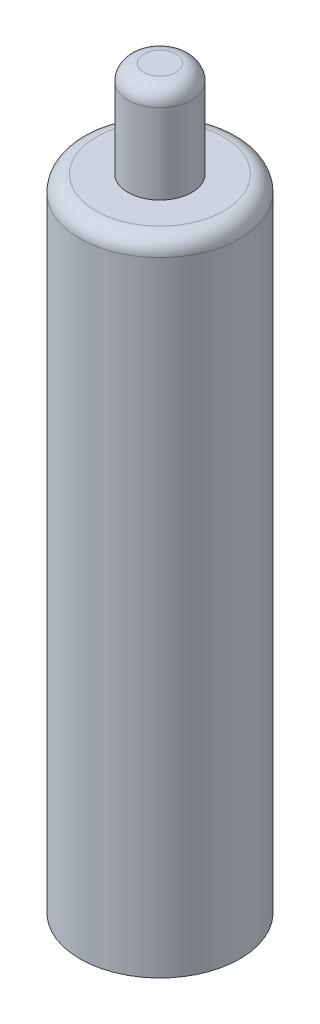
from build123d import *

# Parameters (mm, degrees)
SKETCH1_R           = 2.5
BOSS_EXTRUDE1_DEPTH = 20
SKETCH2_R           = 1
BOSS_EXTRUDE2_DEPTH = 3
FILLET1_R           = 0.5


with BuildPart() as part:
    # Sketch1 → Boss-Extrude1 (new body)
    with BuildSketch(Plane(origin=(0, 0, 0), x_dir=(1, 0, 0), z_dir=(0, 1, 0))):
        with Locations(Location((0, 0, 0), (0, 0, 270))):
            Circle(SKETCH1_R)
    extrude(amount=BOSS_EXTRUDE1_DEPTH)

    # Sketch2 → Boss-Extrude2 (add)
    with BuildSketch(Plane(origin=(0, 20, 0), x_dir=(1, 0, 0), z_dir=(0, 1, 0))):
        with Locations(Location((0, 0, 0), (0, 0, 270))):
            Circle(SKETCH2_R)
    extrude(amount=BOSS_EXTRUDE2_DEPTH)

    # Fillet1
    fillet1_edges = [part.edges().sort_by_distance(p)[0] for p in [
        (0, 20, -2.5),
        (0, 23, -1),
    ]]
    fillet(fillet1_edges, radius=FILLET1_R)


solid = part.part
